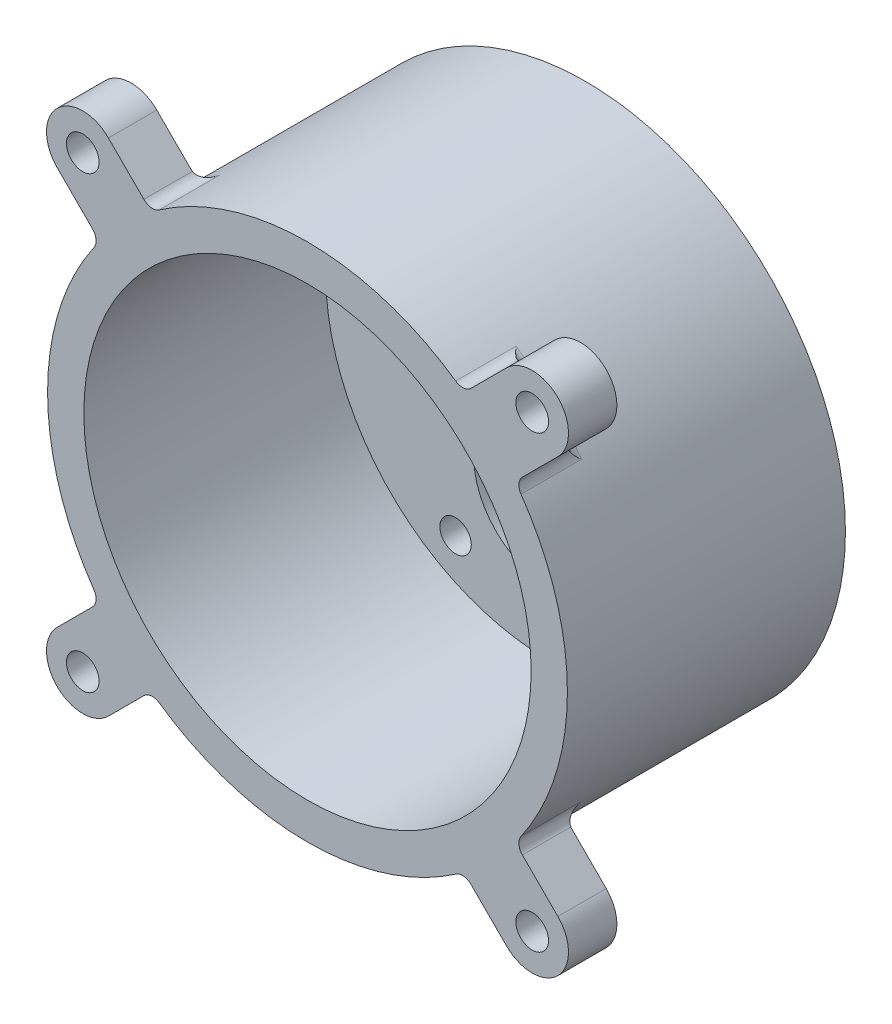
from build123d import *

# Parameters (mm, degrees)
SKETCH1_R               = 21.5
BOSS_EXTRUDE1_DEPTH     = 3
BOSS_EXTRUDE2_START     = 3
SKETCH1_3_R             = 21.5
SKETCH1_3_R_2           = 18.5
BOSS_EXTRUDE2_DEPTH     = 20
CUT_EXTRUDE1_DEPTH      = 39.124795081
CUT_EXTRUDE1_DEPTH_BACK = 39.124795081
SKETCH3_R               = 6.25
SKETCH3_R_2             = 1.3
BOSS_EXTRUDE3_START     = 19
SKETCH4_R               = 1.35
BOSS_EXTRUDE3_DEPTH     = 4
FILLET1_R               = 1


with BuildPart() as part:
    # Sketch1 → Boss-Extrude1 (new body)
    with BuildSketch(Plane.XY):
        Circle(SKETCH1_R)
    extrude(amount=BOSS_EXTRUDE1_DEPTH)

    # Sketch1<3> → Boss-Extrude2 (add)
    with BuildSketch(Plane.XY.offset(BOSS_EXTRUDE2_START)):
        Circle(SKETCH1_3_R)
        Circle(SKETCH1_3_R_2, mode=Mode.SUBTRACT)
    extrude(amount=BOSS_EXTRUDE2_DEPTH)

    # Sketch3 → Cut-Extrude1 (cut, two sides: drawn at the far end of the back side and taken through both)
    with BuildSketch(Plane.XY.offset(-CUT_EXTRUDE1_DEPTH_BACK)):
        with Locations((0, -7)):
            Circle(SKETCH3_R)
        with Locations((7.75, 13.423393759)):
            Circle(SKETCH3_R_2)
        with Locations((-7.75, 13.423393759)):
            Circle(SKETCH3_R_2)
        with Locations((15.5, 0)):
            Circle(SKETCH3_R_2)
        with Locations((-15.5, 0)):
            Circle(SKETCH3_R_2)
        with Locations((7.75, -13.423393759)):
            Circle(SKETCH3_R_2)
        with Locations((-7.75, -13.423393759)):
            Circle(SKETCH3_R_2)
    extrude(amount=CUT_EXTRUDE1_DEPTH + CUT_EXTRUDE1_DEPTH_BACK, mode=Mode.SUBTRACT)

    # Sketch4 → Boss-Extrude3 (add)
    # profile 1 of 4: a face of its own
    with BuildSketch(Plane.XY.offset(BOSS_EXTRUDE3_START)):
        with BuildLine():
            Line((-17.175389561, 12.932748874), (-20.710923467, 16.46828278))
            ThreePointArc((-20.710923467, 16.46828278), (-21.589603123, 18.589603123), (-20.710923467, 20.710923467))
            ThreePointArc((-20.710923467, 20.710923467), (-18.589603123, 21.589603123), (-16.46828278, 20.710923467))
            Line((-16.46828278, 20.710923467), (-12.932748874, 17.175389561))
            ThreePointArc((-12.932748874, 17.175389561), (-15.202795796, 15.202795796), (-17.175389561, 12.932748874))
        make_face()
        with Locations((-18.589603123, 18.589603123)):
            Circle(SKETCH4_R, mode=Mode.SUBTRACT)
    # profile 2 of 4: a face of its own
    with BuildSketch(Plane.XY.offset(BOSS_EXTRUDE3_START)):
        with BuildLine():
            Line((12.932748874, 17.175389561), (16.46828278, 20.710923467))
            ThreePointArc((16.46828278, 20.710923467), (18.589603123, 21.589603123), (20.710923467, 20.710923467))
            ThreePointArc((20.710923467, 20.710923467), (21.589603123, 18.589603123), (20.710923467, 16.46828278))
            Line((20.710923467, 16.46828278), (17.175389561, 12.932748874))
            ThreePointArc((17.175389561, 12.932748874), (15.202795796, 15.202795796), (12.932748874, 17.175389561))
        make_face()
        with Locations((18.589603123, 18.589603123)):
            Circle(SKETCH4_R, mode=Mode.SUBTRACT)
    # profile 3 of 4: a face of its own
    with BuildSketch(Plane.XY.offset(BOSS_EXTRUDE3_START)):
        with BuildLine():
            Line((17.175389561, -12.932748874), (20.710923467, -16.46828278))
            ThreePointArc((20.710923467, -16.46828278), (21.589603123, -18.589603123), (20.710923467, -20.710923467))
            ThreePointArc((20.710923467, -20.710923467), (18.589603123, -21.589603123), (16.46828278, -20.710923467))
            Line((16.46828278, -20.710923467), (12.932748874, -17.175389561))
            ThreePointArc((12.932748874, -17.175389561), (15.202795796, -15.202795796), (17.175389561, -12.932748874))
        make_face()
        with Locations((18.589603123, -18.589603123)):
            Circle(SKETCH4_R, mode=Mode.SUBTRACT)
    # profile 4 of 4: a face of its own
    with BuildSketch(Plane.XY.offset(BOSS_EXTRUDE3_START)):
        with BuildLine():
            Line((-12.932748874, -17.175389561), (-16.46828278, -20.710923467))
            ThreePointArc((-16.46828278, -20.710923467), (-18.589603123, -21.589603123), (-20.710923467, -20.710923467))
            ThreePointArc((-20.710923467, -20.710923467), (-21.589603123, -18.589603123), (-20.710923467, -16.46828278))
            Line((-20.710923467, -16.46828278), (-17.175389561, -12.932748874))
            ThreePointArc((-17.175389561, -12.932748874), (-15.202795796, -15.202795796), (-12.932748874, -17.175389561))
        make_face()
        with Locations((-18.589603123, -18.589603123)):
            Circle(SKETCH4_R, mode=Mode.SUBTRACT)
    extrude(amount=BOSS_EXTRUDE3_DEPTH)

    # Fillet1
    fillet1_edges = [part.edges().sort_by_distance(p)[0] for p in [
        (-17.175389561, -12.932748874, 21),
        (-12.932748874, -17.175389561, 21),
        (-15.202795796, -15.202795796, 19),
        (-12.932748874, 17.175389561, 21),
        (-17.175389561, 12.932748874, 21),
        (-15.202795796, 15.202795796, 19),
        (17.175389561, 12.932748874, 21),
        (12.932748874, 17.175389561, 21),
        (15.202795796, 15.202795796, 19),
        (12.932748874, -17.175389561, 21),
        (17.175389561, -12.932748874, 21),
        (15.202795796, -15.202795796, 19),
    ]]
    fillet(fillet1_edges, radius=FILLET1_R)


solid = part.part
